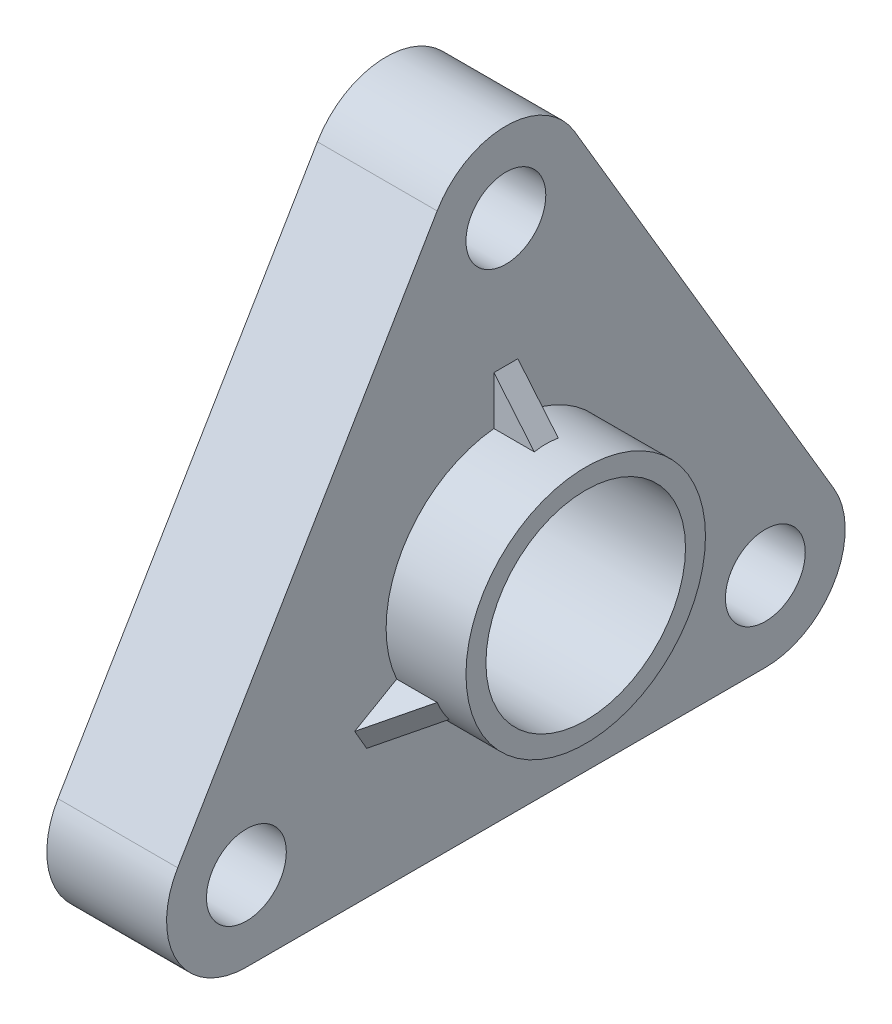
from build123d import *

# Parameters (mm, degrees)
SKETCH1_R           = 12.5
SKETCH1_R_2         = 5
BOSS_EXTRUDE1_DEPTH = 15
SKETCH2_R           = 15
SKETCH2_R_2         = 12.5
BOSS_EXTRUDE2_DEPTH = 10
RIB1_REACH          = 70.119
SKETCH3_WALL_W      = 146.04901068
SKETCH3_WALL_H      = 3
CIRPATTERN1_COUNT   = 3


with BuildPart() as part:
    # Sketch1 → Boss-Extrude1 (new body)
    with BuildSketch(Plane(origin=(0, 0, 0), x_dir=(0, 0, -1), z_dir=(1, 0, 0))):
        with BuildLine():
            Line((-41.109265282, -12.912706879), (-8.609265282, 42.087293121))
            ThreePointArc((-8.609265282, 42.087293121), (0, 47), (8.609265282, 42.087293121))
            Line((8.609265282, 42.087293121), (41.109265282, -12.912706879))
            ThreePointArc((41.109265282, -12.912706879), (41.185416835, -22.956161256), (32.5, -28))
            Line((32.5, -28), (-32.5, -28))
            ThreePointArc((-32.5, -28), (-41.185416835, -22.956161256), (-41.109265282, -12.912706879))
        make_face()
        Circle(SKETCH1_R, mode=Mode.SUBTRACT)
        with Locations((0, 37)):
            Circle(SKETCH1_R_2, mode=Mode.SUBTRACT)
        with Locations((32.5, -18)):
            Circle(SKETCH1_R_2, mode=Mode.SUBTRACT)
        with Locations((-32.5, -18)):
            Circle(SKETCH1_R_2, mode=Mode.SUBTRACT)
    extrude(amount=BOSS_EXTRUDE1_DEPTH)

    # Sketch2 → Boss-Extrude2 (add)
    with BuildSketch(Plane(origin=(15, 0, 0), x_dir=(0, 0, -1), z_dir=(1, 0, 0))):
        Circle(SKETCH2_R)
        Circle(SKETCH2_R_2, mode=Mode.SUBTRACT)
    extrude(amount=BOSS_EXTRUDE2_DEPTH)

    # Sketch3 wall → Rib1 (add, up to next)
    with BuildSketch(Plane(origin=(17.5, 18, 0), x_dir=(-0.640184399664, 0.768221279597, 0), z_dir=(-0.768221279597, -0.640184399664, 0)), mode=Mode.PRIVATE) as rib1_sk1:
        Rectangle(SKETCH3_WALL_W, SKETCH3_WALL_H)
    rib1_tool1 = extrude(rib1_sk1.sketch, amount=RIB1_REACH, mode=Mode.PRIVATE) - part.part
    rib1 = rib1_tool1.solids().sort_by_distance((17.5, 18, 0))[0]
    add(rib1)

    # CirPattern1: Rib1 ×3 about axis
    cirpattern1_axis = Axis((0, 0, 0), (1, 0, 0))
    for i in range(1, CIRPATTERN1_COUNT):
        add(rib1.rotate(cirpattern1_axis, i * 360 / CIRPATTERN1_COUNT))


solid = part.part
